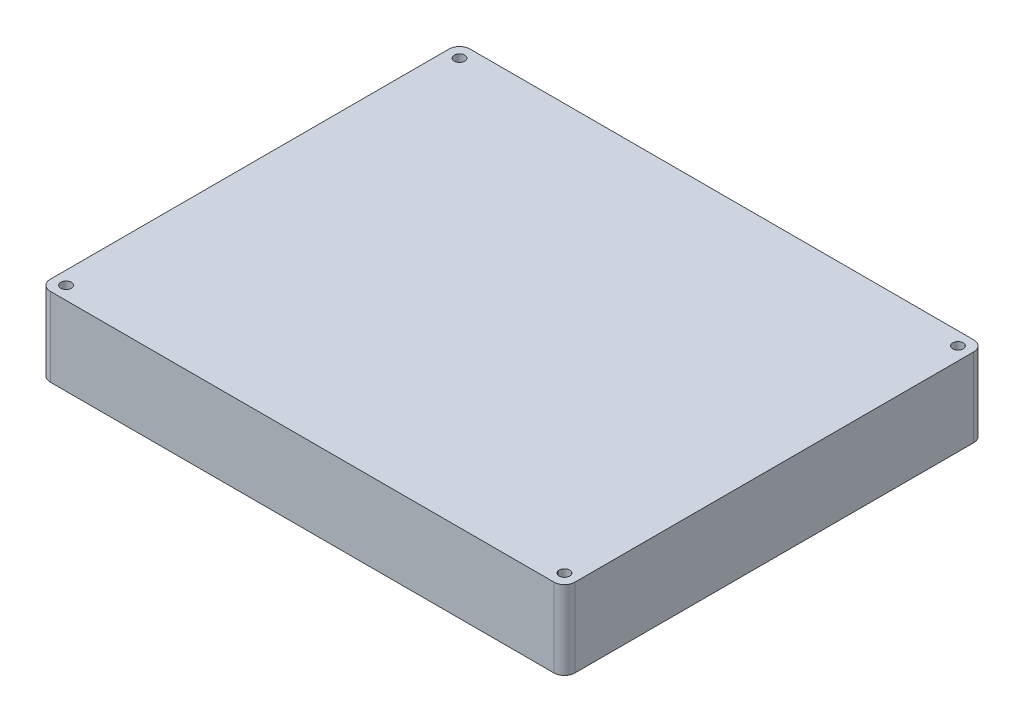
from build123d import *

# Parameters (mm, degrees)
EXTRUDE_1_DEPTH     = 15
SKETCH_2_R          = 1
CUT_EXTRUDE_1_DEPTH = 66.76473219


with BuildPart() as part:
    # 草图1 → 凸台-拉伸1 (new body)
    with BuildSketch(Plane(origin=(0, 0, 0), x_dir=(1, 0, 0), z_dir=(0, 1, 0))):
        with BuildLine():
            Line((48, -40), (-48, -40))
            ThreePointArc((-48, -40), (-49.414213562, -39.414213562), (-50, -38))
            Line((-50, -38), (-50, 38))
            ThreePointArc((-50, 38), (-49.414213562, 39.414213562), (-48, 40))
            Line((-48, 40), (48, 40))
            ThreePointArc((48, 40), (49.414213562, 39.414213562), (50, 38))
            Line((50, 38), (50, -38))
            ThreePointArc((50, -38), (49.414213562, -39.414213562), (48, -40))
        make_face()
    extrude(amount=EXTRUDE_1_DEPTH)

    # 草图2 → 切除-拉伸1 (cut, through all)
    with BuildSketch(Plane(origin=(0, 15, 0), x_dir=(1, 0, 0), z_dir=(0, 1, 0))):
        with Locations(Location((-47.5, 37.5, 0), (0, 0, 270))):
            Circle(SKETCH_2_R)
        with Locations(Location((47.5, 37.5, 0), (0, 0, 270))):
            Circle(SKETCH_2_R)
        with Locations(Location((47.5, -37.5, 0), (0, 0, 270))):
            Circle(SKETCH_2_R)
        with Locations(Location((-47.5, -37.5, 0), (0, 0, 270))):
            Circle(SKETCH_2_R)
    extrude(amount=-CUT_EXTRUDE_1_DEPTH, mode=Mode.SUBTRACT)


solid = part.part
